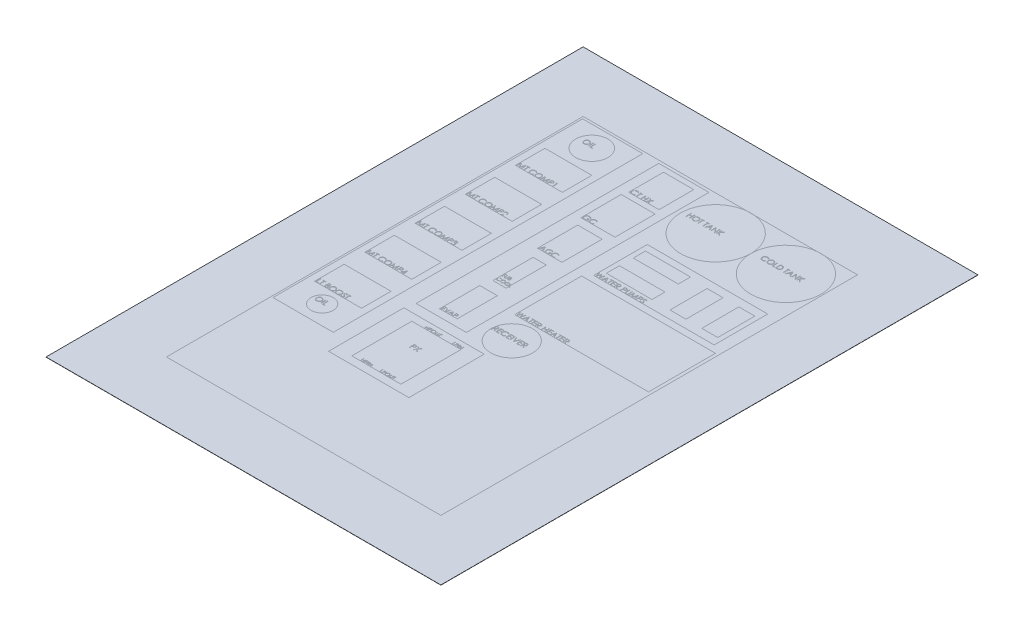
from build123d import *

# Parameters (mm, degrees)
SKETCH1_W           = 5994.4
SKETCH1_H           = 8153.4
BOSS_EXTRUDE1_DEPTH = 2.54


with BuildPart() as part:
    # Sketch1 → Boss-Extrude1 (new body)
    with BuildSketch(Plane(origin=(0, 0, 0), x_dir=(1, 0, 0), z_dir=(0, 1, 0))):
        Rectangle(SKETCH1_W, SKETCH1_H)
    extrude(amount=-BOSS_EXTRUDE1_DEPTH)


solid = part.part
